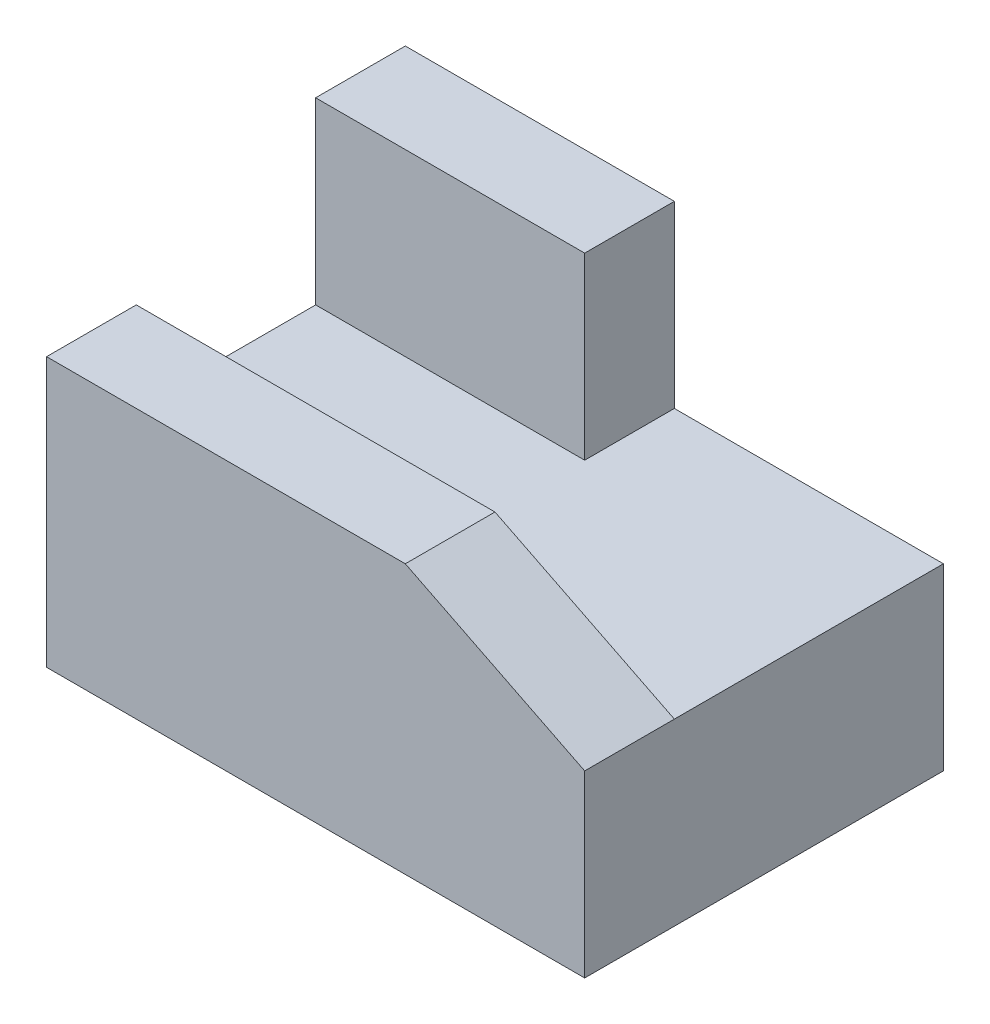
from build123d import *

# Parameters (mm, degrees)
SKETCH_1_W      = 30
SKETCH_1_H      = 20
EXTRUDE_1_DEPTH = 10
EXTRUDE_2_DEPTH = 5
SKETCH_4_W      = 15
SKETCH_4_H      = 10
EXTRUDE_3_DEPTH = 5


with BuildPart() as part:
    # 草圖1 → 填料-伸長1 (new body)
    with BuildSketch(Plane(origin=(0, 0, 0), x_dir=(1, 0, 0), z_dir=(0, 1, 0))):
        with Locations((15, 10)):
            Rectangle(SKETCH_1_W, SKETCH_1_H)
    extrude(amount=EXTRUDE_1_DEPTH)

    # 草圖2 → 填料-伸長2 (add)
    with BuildSketch(Plane.XY):
        Polygon((0, 10), (0, 15), (20, 15), (30, 10), align=None)
    extrude(amount=-EXTRUDE_2_DEPTH)

    # 草圖4 → 填料-伸長3 (add)
    with BuildSketch(Plane(origin=(0, 0, -20), x_dir=(-1, 0, 0), z_dir=(0, 0, -1))):
        with Locations((-7.5, 15)):
            Rectangle(SKETCH_4_W, SKETCH_4_H)
    extrude(amount=-EXTRUDE_3_DEPTH)


solid = part.part
